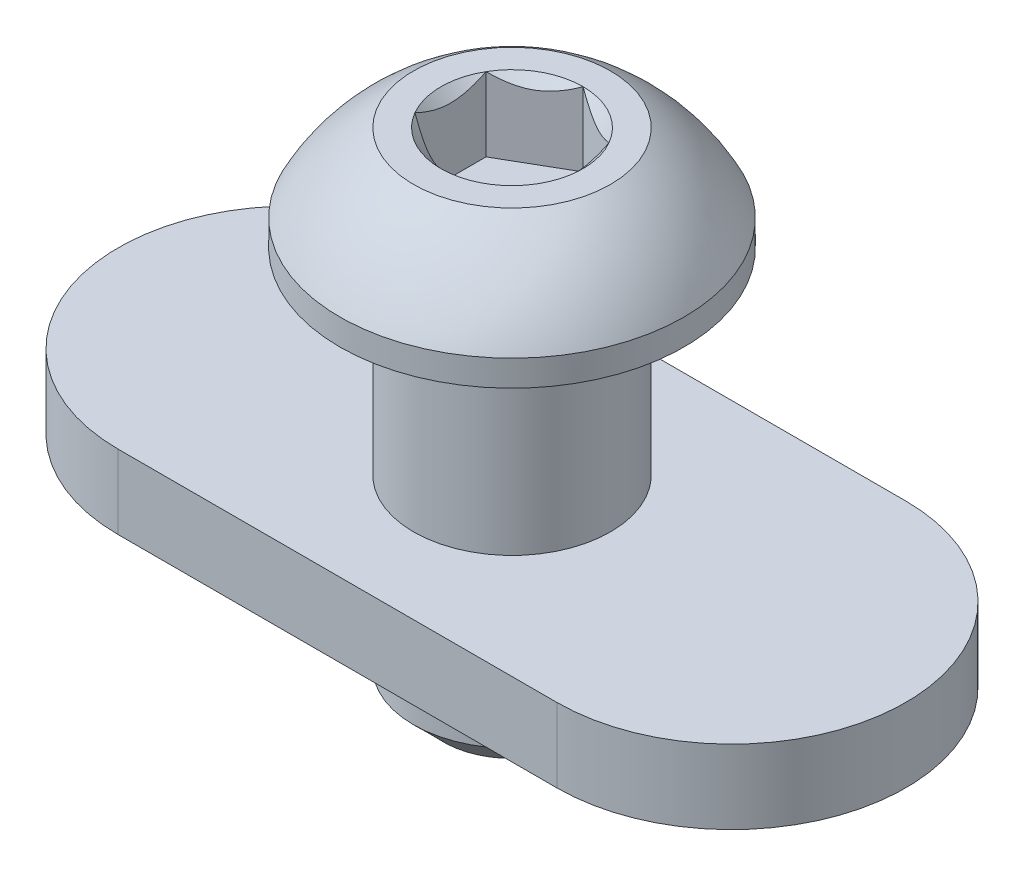
from build123d import *

# Parameters (mm, degrees)
SKETCH1_R           = 3.175
BOSS_EXTRUDE1_DEPTH = 12.7
SKETCH4_OUTSIDE_W   = 14
SKETCH4_OUTSIDE_H   = 14
SKETCH4_OUTSIDE_R   = 2.21262927
CUT_EXTRUDE1_DEPTH  = 1.27
CUT_EXTRUDE1_DRAFT  = -45
CUT_EXTRUDE2_DEPTH  = 2.38125
BOSS_EXTRUDE2_START = -6.35
SKETCH8_R           = 3.175
BOSS_EXTRUDE2_DEPTH = 2.3876
SKETCH9_R           = 3.5687
SKETCH9_R_2         = 3.175
BOSS_EXTRUDE3_DEPTH = 0.762


with BuildPart() as part:
    # Sketch1 → Boss-Extrude1 (new body)
    with BuildSketch(Plane(origin=(0, 0, 0), x_dir=(1, 0, 0), z_dir=(0, 1, 0))):
        Circle(SKETCH1_R)
    extrude(amount=-BOSS_EXTRUDE1_DEPTH)


with BuildPart() as cut_extrude1_tool:
    # Sketch4 outside → Cut-Extrude1 (with draft: the straight prism first)
    with BuildSketch(Plane.XZ.offset(12.7)):
        Rectangle(SKETCH4_OUTSIDE_W, SKETCH4_OUTSIDE_H)
        Circle(SKETCH4_OUTSIDE_R, mode=Mode.SUBTRACT)
    extrude(amount=-CUT_EXTRUDE1_DEPTH)
    # Cut-Extrude1: the draft: its side faces are tilted about the plane it starts from
    cut_extrude1_sides = [cut_extrude1_tool.faces().sort_by_distance(p)[0] for p in [
        (0, -12.065, -7),
        (7, -12.065, 0),
        (0, -12.065, 7),
        (-7, -12.065, 0),
        (-2.21262927, -12.065, 0),
    ]]
    draft(cut_extrude1_sides, Plane.XZ.offset(12.7), CUT_EXTRUDE1_DRAFT)


with BuildPart() as part_1:
    add(part.part)

    # Cut-Extrude1: cut by cut_extrude1_tool
    add(cut_extrude1_tool.part, mode=Mode.SUBTRACT)

    # Sketch5 → Revolve1 (revolve)
    with BuildSketch(Plane.XY):
        with BuildLine():
            Line((0, 0), (0, 3.3528))
            Line((0, 3.3528), (-3.175, 3.3528))
            ThreePointArc((-3.175, 3.3528), (-4.540019085, 2.263204136), (-5.5499, 0.8382))
            Line((-5.5499, 0.8382), (-5.5499, 0))
            Line((-5.5499, 0), (0, 0))
        make_face()
    revolve(axis=Axis((0, 0, 0), (0, 1, 0)))

    # Sketch6 → Cut-Extrude2 (cut)
    with BuildSketch(Plane(origin=(0, 3.3528, 0), x_dir=(1, 0, 0), z_dir=(0, 1, 0))):
        Polygon((0, 2.291358881), (-1.984375, 1.14567944), (-1.984375, -1.14567944), (0, -2.291358881), (1.984375, -1.14567944), (1.984375, 1.14567944), align=None)
    extrude(amount=-CUT_EXTRUDE2_DEPTH, mode=Mode.SUBTRACT)

    # Cut-Extrude3 cone 1 section (through the dimple's axis) → Cut-Extrude3 (revolve, cut)
    with BuildSketch(Plane(origin=(0, 3.3528, 0), x_dir=(0, 0, 1), z_dir=(1, 0, 0))):
        Polygon((0, 0), (2.291358881, 0), (0, 2.291358881), align=None)
    revolve(axis=Axis((0, 3.3528, 0), (0, -1, 0)), mode=Mode.SUBTRACT)


with BuildPart() as body_2:
    # Sketch8 → Boss-Extrude2 (new body)
    with BuildSketch(Plane(origin=(0, 0, 0), x_dir=(1, 0, 0), z_dir=(0, 1, 0)).offset(BOSS_EXTRUDE2_START)):
        with BuildLine():
            Line((-7.0739, 5.6261), (7.0739, 5.6261))
            ThreePointArc((7.0739, 5.6261), (12.7, 0), (7.0739, -5.6261))
            Line((7.0739, -5.6261), (-7.0739, -5.6261))
            ThreePointArc((-7.0739, -5.6261), (-12.7, 0), (-7.0739, 5.6261))
        make_face()
        Circle(SKETCH8_R, mode=Mode.SUBTRACT)
    extrude(amount=-BOSS_EXTRUDE2_DEPTH)

    # Sketch9 → Boss-Extrude3 (add)
    with BuildSketch(Plane.XZ.offset(8.7376)):
        Circle(SKETCH9_R)
        Circle(SKETCH9_R_2, mode=Mode.SUBTRACT)
    extrude(amount=BOSS_EXTRUDE3_DEPTH)


solid = Compound([part_1.part, body_2.part])
